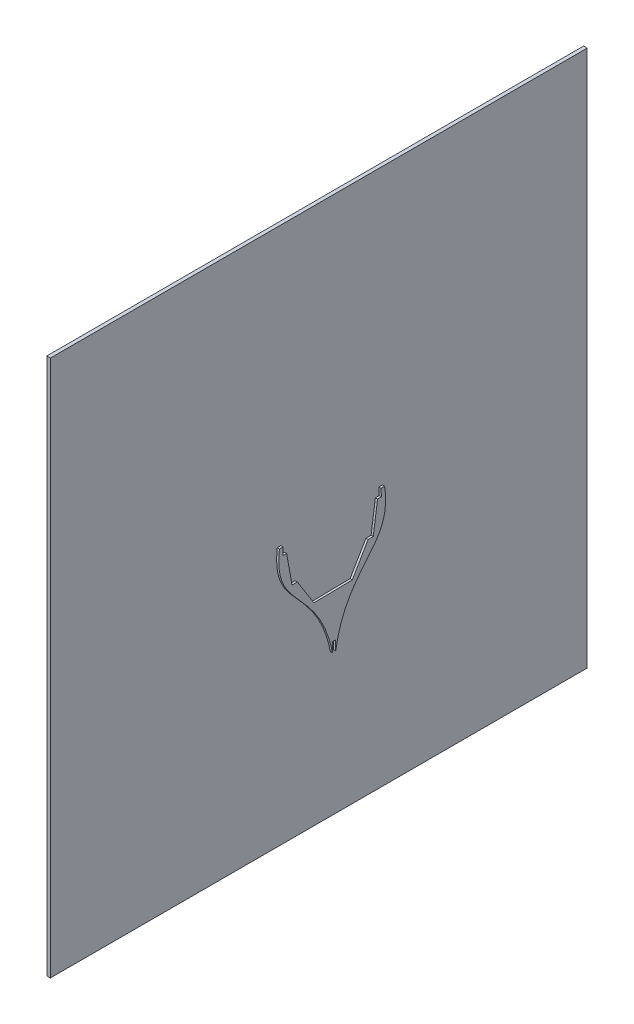
from build123d import *

# Parameters (mm, degrees)
BOSS_EXTRU_2_DEPTH      = 10
BOSS_EXTRU_3_DEPTH      = 6
ENL_V_MAT_EXTRU_1_DEPTH = 6


with BuildPart() as part:
    # Esquisse3D1 → Boss.-Extru.2 (new body)
    with BuildSketch(Plane(origin=(-20, 1121.289346724, 777.274991403), x_dir=(0, -0.7071067811865476, -0.7071067811865476), z_dir=(1, 0, 0))):
        Polygon((0, 0), (1060.66017178, 1060.66017178), (2121.32034356, 0), (1060.66017178, -1060.66017178), align=None)
    extrude(amount=BOSS_EXTRU_2_DEPTH)


with BuildPart() as body_2:
    # Esquisse5 → Boss.-Extru.3 (new body)
    with BuildSketch(Plane(origin=(0, 0, 0), x_dir=(0, 0, -1), z_dir=(1, 0, 0))):
        with BuildLine():
            Line((140.47611598, 360.503481807), (130.47611598, 360.322328034))
            Line((130.47611598, 360.322328034), (131.657650758, 339.229506667))
            Line((131.657650758, 339.229506667), (120.887950689, 339.034409488))
            Line((120.887950689, 339.034409488), (108.873341206, 254.593532728))
            Line((108.873341206, 254.593532728), (94.34542638, 254.33035407))
            Line((94.34542638, 254.33035407), (50.32147665, 178.769822999))
            Line((50.32147665, 178.769822999), (-56.763300542, 176.829941862))
            Line((-56.763300542, 176.829941862), (-103.495082298, 250.746398619))
            Line((-103.495082298, 250.746398619), (-118.022997124, 250.483219961))
            Line((-118.022997124, 250.483219961), (-133.088076626, 334.433537939))
            Line((-133.088076626, 334.433537939), (-143.857776696, 334.238440759))
            Line((-143.857776696, 334.238440759), (-143.440975271, 355.360216589))
            Line((-143.440975271, 355.360216589), (-153.440975271, 355.179062817))
            add(Edge.make_bspline(
                [(0, 0), (-4.612294832, 18.064961959), (-17.103706204, 237.675764763), (-174.400842663, 174.645351927), (-153.440975271, 355.179062817)],
                knots=[0, 0, 0, 0, 0, 1, 1, 1, 1, 1], degree=4))
            add(Edge.make_bspline(
                [(0, 0), (3.954976136, 18.220161304), (8.484136835, 238.139298193), (167.960957982, 180.847365104), (140.47611598, 360.503481807)],
                knots=[0, 0, 0, 0, 0, 1, 1, 1, 1, 1], degree=4))
        make_face()
    extrude(amount=BOSS_EXTRU_3_DEPTH)

    # Esquisse6 → Enlèv. mat.-Extru.1 (cut)
    with BuildSketch(Plane(origin=(6, 0, 0), x_dir=(0, 0, -1), z_dir=(1, 0, 0))):
        Polygon((-5.044525173, 29.977207473), (-5.533640359, 56.977207473), (3.466359641, 57.140245868), (3.955474827, 30.140245868), (117.063261114, -47.52702125), (-85.227699586, -65.220017949), align=None)
    extrude(amount=-ENL_V_MAT_EXTRU_1_DEPTH, mode=Mode.SUBTRACT)


solid = Compound([part.part, body_2.part])
